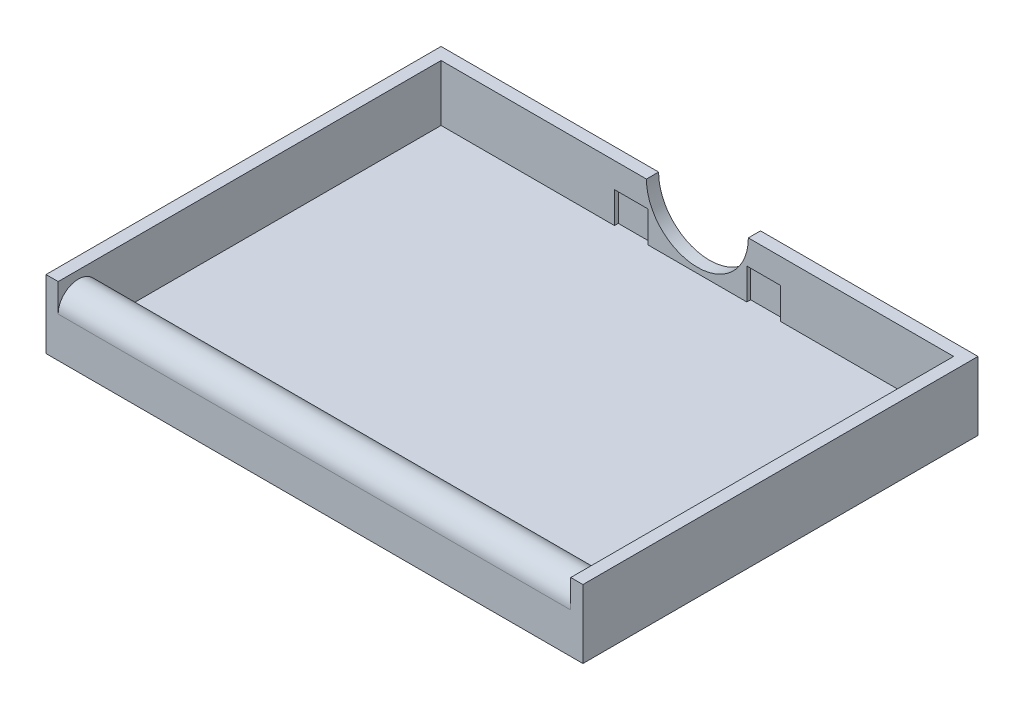
from build123d import *

# Parameters (mm, degrees)
SKETCH1_W            = 70.4
SKETCH1_H            = 50.7
BOSS_EXTRUDE1_DEPTH  = 1.6
SKETCH2_W            = 70.4
SKETCH2_H            = 2.3
BOSS_EXTRUDE2_DEPTH  = 3.3
SKETCH4_R            = 2.3
BOSS_EXTRUDE3_DEPTH  = 70.4
BOSS_EXTRUDE4_DEPTH  = 6.6
SKETCH6_R            = 6.7
CUT_EXTRUDE1_DEPTH   = 6.6
SKETCH7_W            = 4.1
SKETCH7_H            = 3.3
CUT_EXTRUDE2_DEPTH   = 0.5
SKETCH9_W            = 70.4
SKETCH9_H            = 50.7
BOSS_EXTRUDE5_DEPTH  = 0.8
CUT_EXTRUDE3_DEPTH   = 0.8
BOSS_EXTRUDE6_DEPTH  = 0.2
CUT_EXTRUDE4_DEPTH   = 0.2
SKETCH13_W           = 4.1
SKETCH13_H           = 4.1
CUT_EXTRUDE5_DEPTH   = 0.2
SKETCH14_W           = 50.9
SKETCH14_H           = 9
BOSS_EXTRUDE7_DEPTH  = 0.1
CUT_EXTRUDE6_START   = -0.1
CUT_EXTRUDE6_DEPTH   = 0.1
CUT_EXTRUDE7_DEPTH   = 0.1
SKETCH17_W           = 50.9
SKETCH17_H           = 9
BOSS_EXTRUDE8_DEPTH  = 0.1
SKETCH18_W           = 0.5
SKETCH18_H           = 4.1
CUT_EXTRUDE8_DEPTH   = 0.2
SKETCH19_W           = 0.5
SKETCH19_H           = 4.1
CUT_EXTRUDE9_DEPTH   = 0.2
SKETCH21_W           = 0.5
SKETCH21_H           = 4.1
CUT_EXTRUDE10_DEPTH  = 0.1
SKETCH22_W           = 0.5
SKETCH22_H           = 4.1
CUT_EXTRUDE11_DEPTH  = 0.1
SKETCH24_W           = 67.4
SKETCH24_H           = 15.486571252
CUT_EXTRUDE12_DEPTH  = 23.1
SKETCH25_W           = 67.4
SKETCH25_H           = 1.6
BOSS_EXTRUDE9_DEPTH  = 3.7
SKETCH26_R           = 2.65
BOSS_EXTRUDE10_DEPTH = 67.7
BOSS_EXTRUDE13_DEPTH = 1.05


with BuildPart() as part:
    # Sketch1 → Boss-Extrude1 (new body)
    with BuildSketch(Plane(origin=(0, 0, 0), x_dir=(1, 0, 0), z_dir=(0, 1, 0))):
        with Locations((35.2, -25.35)):
            Rectangle(SKETCH1_W, SKETCH1_H)
    extrude(amount=BOSS_EXTRUDE1_DEPTH)

    # Sketch2 → Boss-Extrude2 (add)
    with BuildSketch(Plane(origin=(0, 1.6, 0), x_dir=(1, 0, 0), z_dir=(0, 1, 0))):
        with Locations((35.2, -49.55)):
            Rectangle(SKETCH2_W, SKETCH2_H)
    extrude(amount=BOSS_EXTRUDE2_DEPTH)

    # Sketch4 → Boss-Extrude3 (add)
    with BuildSketch(Plane.ZY):
        with Locations((48.4, 4.9)):
            Circle(SKETCH4_R)
    extrude(amount=-BOSS_EXTRUDE3_DEPTH)

    # Sketch5 → Boss-Extrude4 (add)
    with BuildSketch(Plane(origin=(0, 1.6, 0), x_dir=(1, 0, 0), z_dir=(0, 1, 0))):
        Polygon((1.6, -1.6), (68.8, -1.6), (68.8, -50.7), (70.4, -50.7), (70.4, 0), (0, 0), (0, -50.7), (1.6, -50.7), align=None)
    extrude(amount=BOSS_EXTRUDE4_DEPTH)

    # Sketch6 → Cut-Extrude1 (cut)
    with BuildSketch(Plane.XY.offset(1.6)):
        with Locations((35.2, 8.2)):
            Circle(SKETCH6_R)
    extrude(amount=-CUT_EXTRUDE1_DEPTH, mode=Mode.SUBTRACT)

    # Sketch7 → Cut-Extrude2 (cut)
    with BuildSketch(Plane.XY.offset(1.6)):
        with Locations((43.95, 3.25)):
            Rectangle(SKETCH7_W, SKETCH7_H)
        with Locations((26.45, 3.25)):
            Rectangle(SKETCH7_W, SKETCH7_H)
    extrude(amount=-CUT_EXTRUDE2_DEPTH, mode=Mode.SUBTRACT)

    # Sketch9 → Boss-Extrude5 (add)
    with BuildSketch(Plane.XZ):
        with Locations((35.2, 25.35)):
            Rectangle(SKETCH9_W, SKETCH9_H)
    extrude(amount=BOSS_EXTRUDE5_DEPTH)

    # Sketch10 → Cut-Extrude3 (cut)
    with BuildSketch(Plane(origin=(0, 1.6, 0), x_dir=(1, 0, 0), z_dir=(0, 1, 0))):
        Polygon((24.4, -1.6), (1.6, -1.6), (1.6, -48.4), (68.8, -48.4), (68.8, -1.6), (46, -1.6), (46, -1.1), (41.9, -1.1), (41.9, -1.6), (36.353256259, -1.6), (34.046743741, -1.6), (28.5, -1.6), (28.5, -1.1), (24.4, -1.1), align=None)
    extrude(amount=-CUT_EXTRUDE3_DEPTH, mode=Mode.SUBTRACT)

    # Sketch11 → Boss-Extrude6 (add)
    with BuildSketch(Plane(origin=(0, 0, 0), x_dir=(-1, 0, 0), z_dir=(0, 0, -1))):
        with BuildLine():
            Line((0, 8.2), (-28.5, 8.2))
            ThreePointArc((-28.5, 8.2), (-35.2, 1.5), (-41.9, 8.2))
            Line((-41.9, 8.2), (-70.4, 8.2))
            Line((-70.4, 8.2), (-70.4, -0.8))
            Line((-70.4, -0.8), (0, -0.8))
            Line((0, -0.8), (0, 8.2))
        make_face()
    extrude(amount=BOSS_EXTRUDE6_DEPTH)

    # Sketch12 → Cut-Extrude4 (cut)
    with BuildSketch(Plane.XY.offset(1.6)):
        with BuildLine():
            Line((28.5, 4.9), (28.5, 0.8))
            Line((28.5, 0.8), (41.9, 0.8))
            Line((41.9, 0.8), (41.9, 4.9))
            Line((41.9, 4.9), (46, 4.9))
            Line((46, 4.9), (46, 0.8))
            Line((46, 0.8), (68.8, 0.8))
            Line((68.8, 0.8), (68.8, 8.2))
            Line((68.8, 8.2), (41.9, 8.2))
            ThreePointArc((41.9, 8.2), (35.2, 1.5), (28.5, 8.2))
            Line((28.5, 8.2), (1.6, 8.2))
            Line((1.6, 8.2), (1.6, 0.8))
            Line((1.6, 0.8), (24.4, 0.8))
            Line((24.4, 0.8), (24.4, 4.9))
            Line((24.4, 4.9), (28.5, 4.9))
        make_face()
    extrude(amount=-CUT_EXTRUDE4_DEPTH, mode=Mode.SUBTRACT)

    # Sketch13 → Cut-Extrude5 (cut)
    with BuildSketch(Plane.XY.offset(1.1)):
        with Locations((43.95, 2.85)):
            Rectangle(SKETCH13_W, SKETCH13_H)
        with Locations((26.45, 2.85)):
            Rectangle(SKETCH13_W, SKETCH13_H)
    extrude(amount=-CUT_EXTRUDE5_DEPTH, mode=Mode.SUBTRACT)

    # Sketch14 → Boss-Extrude7 (add)
    with BuildSketch(Plane.ZY):
        with Locations((25.25, 3.7)):
            Rectangle(SKETCH14_W, SKETCH14_H)
    extrude(amount=BOSS_EXTRUDE7_DEPTH)

    # Sketch15 → Cut-Extrude6 (cut)
    with BuildSketch(Plane(origin=(1.6, 0, 0), x_dir=(0, 0, -1), z_dir=(1, 0, 0)).offset(CUT_EXTRUDE6_START)):
        with BuildLine():
            Line((-48.4, 2.6), (-48.4, 0.8))
            Line((-48.4, 0.8), (-1.4, 0.8))
            Line((-1.4, 0.8), (-1.4, 8.2))
            Line((-1.4, 8.2), (-50.7, 8.2))
            Line((-50.7, 8.2), (-50.7, 4.9))
            ThreePointArc((-50.7, 4.9), (-46.773654403, 6.526345597), (-48.4, 2.6))
        make_face()
    extrude(amount=CUT_EXTRUDE6_DEPTH, mode=Mode.SUBTRACT)

    # Sketch16 → Cut-Extrude7 (cut)
    with BuildSketch(Plane.ZY.offset(-68.8)):
        with BuildLine():
            Line((50.7, 8.2), (1.4, 8.2))
            Line((1.4, 8.2), (1.4, 0.8))
            Line((1.4, 0.8), (48.4, 0.8))
            Line((48.4, 0.8), (48.4, 2.6))
            ThreePointArc((48.4, 2.6), (46.773654403, 6.526345597), (50.7, 4.9))
            Line((50.7, 4.9), (50.7, 8.2))
        make_face()
    extrude(amount=-CUT_EXTRUDE7_DEPTH, mode=Mode.SUBTRACT)

    # Sketch17 → Boss-Extrude8 (add)
    with BuildSketch(Plane(origin=(70.4, 0, 0), x_dir=(0, 0, -1), z_dir=(1, 0, 0))):
        with Locations((-25.25, 3.7)):
            Rectangle(SKETCH17_W, SKETCH17_H)
    extrude(amount=BOSS_EXTRUDE8_DEPTH)

    # Sketch18 → Cut-Extrude8 (cut)
    with BuildSketch(Plane(origin=(41.9, 0, 0), x_dir=(0, 0, -1), z_dir=(1, 0, 0))):
        with Locations((-1.15, 2.85)):
            Rectangle(SKETCH18_W, SKETCH18_H)
    extrude(amount=-CUT_EXTRUDE8_DEPTH, mode=Mode.SUBTRACT)

    # Sketch19 → Cut-Extrude9 (cut)
    with BuildSketch(Plane.ZY.offset(-28.5)):
        with Locations((1.15, 2.85)):
            Rectangle(SKETCH19_W, SKETCH19_H)
    extrude(amount=-CUT_EXTRUDE9_DEPTH, mode=Mode.SUBTRACT)

    # Sketch21 → Cut-Extrude10 (cut)
    with BuildSketch(Plane.ZY.offset(-46)):
        with Locations((1.15, 2.85)):
            Rectangle(SKETCH21_W, SKETCH21_H)
    extrude(amount=-CUT_EXTRUDE10_DEPTH, mode=Mode.SUBTRACT)

    # Sketch22 → Cut-Extrude11 (cut)
    with BuildSketch(Plane(origin=(24.4, 0, 0), x_dir=(0, 0, -1), z_dir=(1, 0, 0))):
        with Locations((-1.15, 2.85)):
            Rectangle(SKETCH22_W, SKETCH22_H)
    extrude(amount=-CUT_EXTRUDE11_DEPTH, mode=Mode.SUBTRACT)

    # Sketch24 → Cut-Extrude12 (cut)
    with BuildSketch(Plane(origin=(0, 0.8, 0), x_dir=(1, 0, 0), z_dir=(0, 1, 0))):
        with Locations((35.2, -45.729904974)):
            Rectangle(SKETCH24_W, SKETCH24_H)
    extrude(amount=CUT_EXTRUDE12_DEPTH, mode=Mode.SUBTRACT)

    # Sketch25 → Boss-Extrude9 (add)
    with BuildSketch(Plane(origin=(0, 0.8, 0), x_dir=(1, 0, 0), z_dir=(0, 1, 0))):
        with Locations((35.2, -49.9)):
            Rectangle(SKETCH25_W, SKETCH25_H)
    extrude(amount=BOSS_EXTRUDE9_DEPTH)

    # Sketch26 → Boss-Extrude10 (add)
    with BuildSketch(Plane(origin=(1.5, 0, 0), x_dir=(0, 0, -1), z_dir=(1, 0, 0))):
        with Locations((-49.1, 4.5)):
            Circle(SKETCH26_R)
    extrude(amount=BOSS_EXTRUDE10_DEPTH)

    # Sketch27 → Boss-Extrude13 (add)
    with BuildSketch(Plane.XY.offset(50.7)):
        Polygon((68.9, -0.8), (70.5, -0.8), (70.5, 4.77), (70.5, 8.2), (68.9, 8.2), (68.9, 6.612463017), (69.2, 6.612463017), (69.2, 2.387536983), (1.5, 2.387536983), (1.5, 4.5), (1.5, 6.612463017), (1.5, 8.2), (-0.1, 8.2), (-0.1, 4.77), (-0.1, -0.8), (1.5, -0.8), align=None)
        Polygon((69.2, 6.612463017), (68.9, 6.612463017), (68.9, 4.5), (1.5, 4.5), (1.5, 2.387536983), (69.2, 2.387536983), align=None)
    extrude(amount=BOSS_EXTRUDE13_DEPTH)


solid = part.part
